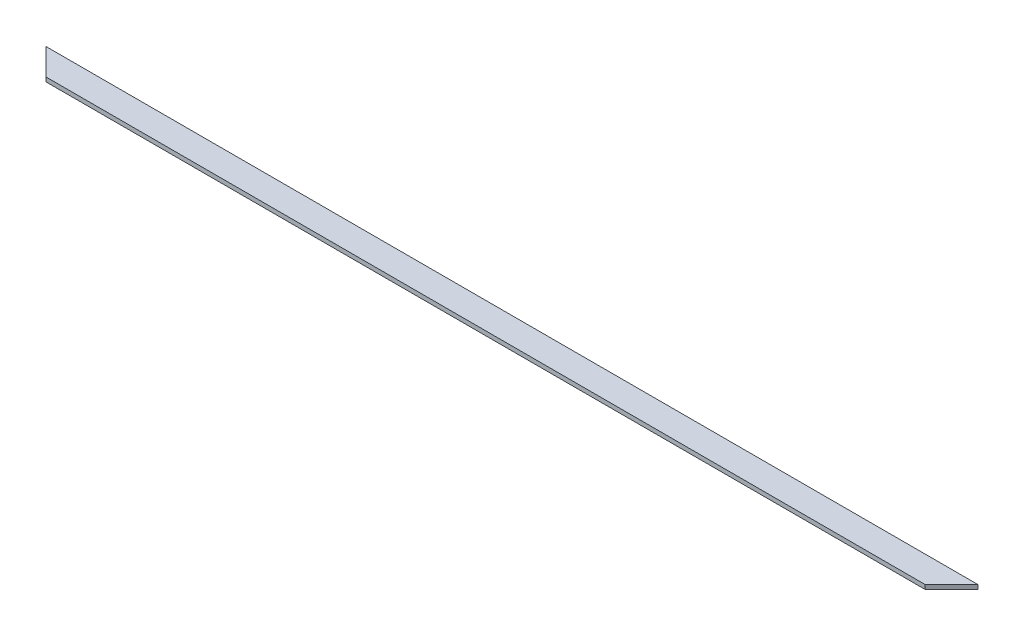
from build123d import *

# Parameters (mm, degrees)
BOSS_EXTRUDE1_DEPTH = 21.59


with BuildPart() as part:
    # Sketch1 → Boss-Extrude1 (new body)
    with BuildSketch(Plane(origin=(0, 0, 0), x_dir=(1, 0, 0), z_dir=(0, 1, 0))):
        Polygon((-1481.850255102, 921.397959184), (3228.262244898, 921.397959184), (3094.912244898, 788.047959184), (-1348.500255102, 788.047959184), align=None)
    extrude(amount=BOSS_EXTRUDE1_DEPTH)


solid = part.part
